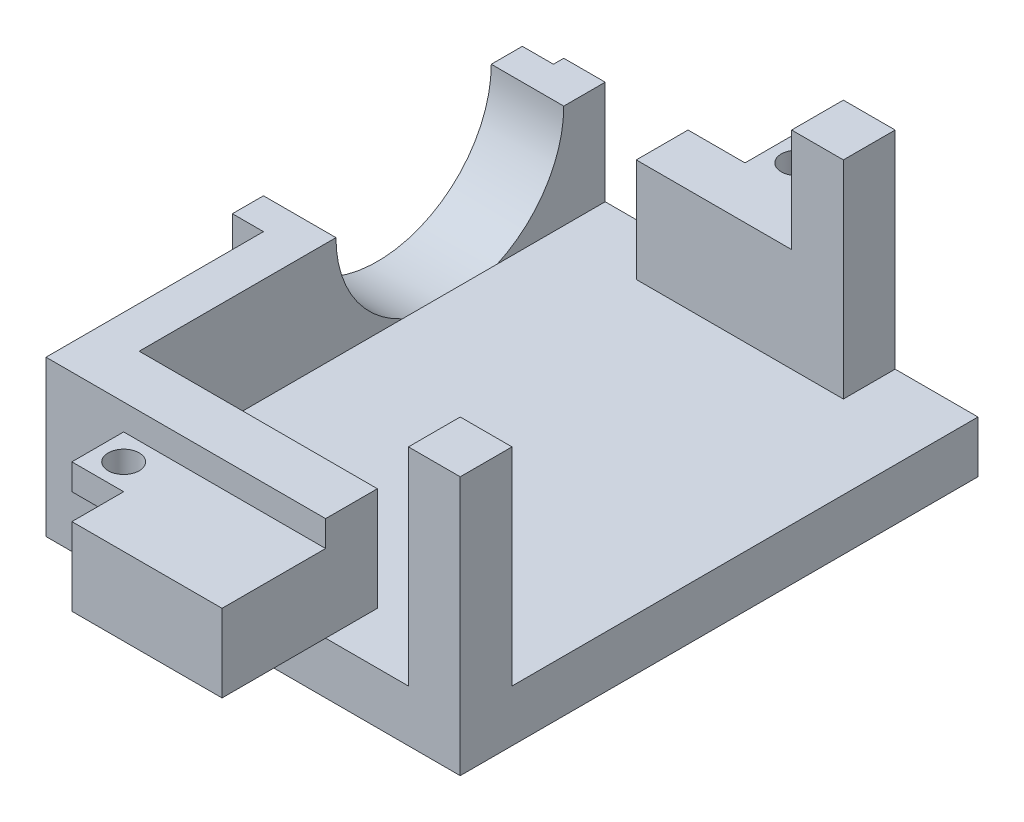
from build123d import *

# Parameters (mm, degrees)
SKETCH1_W            = 40
SKETCH1_H            = 50
BOSS_EXTRUDE1_DEPTH  = 5
SKETCH3_W            = 5
SKETCH3_H            = 5
BOSS_EXTRUDE5_DEPTH  = 20
SKETCH3_3_W          = 15
SKETCH3_3_H          = 5
BOSS_EXTRUDE6_DEPTH  = 10
CUT_EXTRUDE3_DEPTH   = 4
BOSS_EXTRUDE9_START  = 3
BOSS_EXTRUDE9_DEPTH  = 3
SKETCH12_W           = 5
SKETCH12_H           = 5
BOSS_EXTRUDE10_DEPTH = 5
SKETCH13_R           = 1.5
CUT_EXTRUDE4_DEPTH   = 5
SKETCH16_W           = 5
SKETCH16_H           = 2.5
BOSS_EXTRUDE13_DEPTH = 5
BOSS_EXTRUDE14_DEPTH = 10
SKETCH17_R           = 1.5
CUT_EXTRUDE6_DEPTH   = 2.5


with BuildPart() as part:
    # Sketch1 → Boss-Extrude1 (new body)
    with BuildSketch(Plane(origin=(0, 0, 0), x_dir=(1, 0, 0), z_dir=(0, 1, 0))):
        Rectangle(SKETCH1_W, SKETCH1_H)
    extrude(amount=BOSS_EXTRUDE1_DEPTH)

    # Sketch3 → Boss-Extrude5 (add)
    with BuildSketch(Plane(origin=(0, 5, 0), x_dir=(1, 0, 0), z_dir=(0, 1, 0))):
        with Locations((9.5, 22.5)):
            Rectangle(SKETCH3_W, SKETCH3_H)
        with Locations((17.5, -22.5)):
            Rectangle(SKETCH3_W, SKETCH3_H)
    extrude(amount=BOSS_EXTRUDE5_DEPTH)

    # Sketch3<3> → Boss-Extrude6 (add)
    with BuildSketch(Plane(origin=(0, 5, 0), x_dir=(1, 0, 0), z_dir=(0, 1, 0))):
        with Locations((-0.5, 22.5)):
            Rectangle(SKETCH3_3_W, SKETCH3_3_H)
        Polygon((-16, -20), (-16, 25), (-20, 25), (-20, -25), (7, -25), (7, -20), align=None)
    extrude(amount=BOSS_EXTRUDE6_DEPTH)

    # Sketch8 → Cut-Extrude3 (cut)
    with BuildSketch(Plane.ZY.offset(20)):
        with BuildLine():
            Line((1, 15), (-21, 15))
            ThreePointArc((-21, 15), (-10, 4), (1, 15))
        make_face()
    extrude(amount=-CUT_EXTRUDE3_DEPTH, mode=Mode.SUBTRACT)

    # Sketch10 → Boss-Extrude9 (add)
    with BuildSketch(Plane.ZY.offset(20).offset(BOSS_EXTRUDE9_START)):
        with BuildLine():
            Line((1, 15), (4, 15))
            Line((4, 15), (4, 0))
            Line((4, 0), (-24, 0))
            Line((-24, 0), (-24, 15))
            Line((-24, 15), (-21, 15))
            ThreePointArc((-21, 15), (-10, 4), (1, 15))
        make_face()
    extrude(amount=-BOSS_EXTRUDE9_DEPTH)

    # Sketch12 → Boss-Extrude10 (add)
    with BuildSketch(Plane(origin=(0, 0, -25), x_dir=(-1, 0, 0), z_dir=(0, 0, -1))):
        with Locations((0, 12.5)):
            Rectangle(SKETCH12_W, SKETCH12_H)
    extrude(amount=BOSS_EXTRUDE10_DEPTH)

    # Sketch13 → Cut-Extrude4 (cut)
    with BuildSketch(Plane.XZ.offset(-10)):
        with Locations((0, -27.5)):
            Circle(SKETCH13_R)
    extrude(amount=-CUT_EXTRUDE4_DEPTH, mode=Mode.SUBTRACT)

    # Sketch16 → Boss-Extrude13 (add)
    with BuildSketch(Plane.XY.offset(25)):
        with Locations((-10, 11.25)):
            Rectangle(SKETCH16_W, SKETCH16_H)
    extrude(amount=BOSS_EXTRUDE13_DEPTH)

    # Sketch16<3> → Boss-Extrude14 (add)
    with BuildSketch(Plane.XY.offset(25)):
        Polygon((-7.5, 5), (7, 5), (7, 12.5), (-7.5, 12.5), (-7.5, 10), align=None)
    extrude(amount=BOSS_EXTRUDE14_DEPTH)

    # Sketch17 → Cut-Extrude6 (cut)
    with BuildSketch(Plane.XZ.offset(-10)):
        with Locations((-10, 27.5)):
            Circle(SKETCH17_R)
    extrude(amount=-CUT_EXTRUDE6_DEPTH, mode=Mode.SUBTRACT)


solid = part.part
